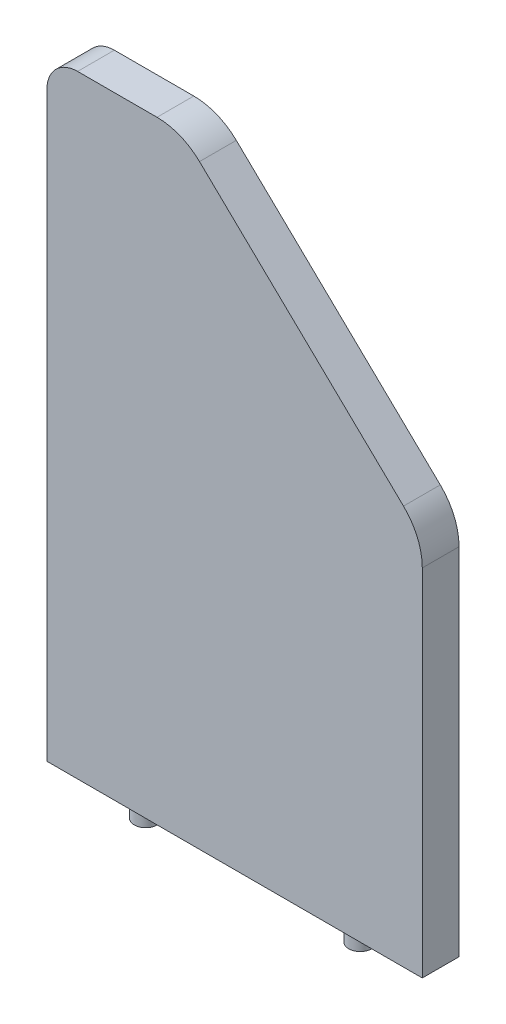
from build123d import *

# Parameters (mm, degrees)
SKETCH4_W                    = 122.5
SKETCH4_H                    = 200
BOSS_EXTRUDE1_DEPTH          = 12
CUT_EXTRUDE1_DEPTH           = 12
FILLET1_R                    = 20
FILLET2_R                    = 20
FILLET3_R                    = 10
SKETCH10_R                   = 3.75
BOSS_EXTRUDE3_DEPTH          = 6
F_5_0_5_DIAMETER_HOLE1_D     = 5
F_5_0_5_DIAMETER_HOLE1_DEPTH = 8
F_5_0_5_DIAMETER_HOLE1_TIP   = 1.502151548
F_5_0_5_DIAMETER_HOLE2_D     = 5
F_5_0_5_DIAMETER_HOLE2_DEPTH = 8
F_5_0_5_DIAMETER_HOLE2_TIP   = 1.502151548


with BuildPart() as part:
    # Sketch4 → Boss-Extrude1 (new body)
    with BuildSketch(Plane.XY):
        with Locations((61.25, 100)):
            Rectangle(SKETCH4_W, SKETCH4_H)
    extrude(amount=BOSS_EXTRUDE1_DEPTH)

    # Sketch7 → Cut-Extrude1 (cut)
    with BuildSketch(Plane.XY.offset(12)):
        Polygon((43.985796602, 200), (122.5, 124.415794753), (122.5, 200), align=None)
    extrude(amount=-CUT_EXTRUDE1_DEPTH, mode=Mode.SUBTRACT)

    # Fillet1
    fillet1_edges = [part.edges().sort_by_distance(p)[0] for p in [
        (43.985796602, 200, 6),
    ]]
    fillet(fillet1_edges, radius=FILLET1_R)

    # Fillet2
    fillet2_edges = [part.edges().sort_by_distance(p)[0] for p in [
        (122.5, 124.415794753, 6),
    ]]
    fillet(fillet2_edges, radius=FILLET2_R)

    # Fillet3
    fillet3_edges = [part.edges().sort_by_distance(p)[0] for p in [
        (0, 200, 6),
    ]]
    fillet(fillet3_edges, radius=FILLET3_R)

    # Sketch10 → Boss-Extrude3 (add)
    with BuildSketch(Plane.XZ):
        with Locations(Location((26.25, 6, 0), (0, 0, 90))):
            Circle(SKETCH10_R)
        with Locations(Location((96.25, 6, 0), (0, 0, 90))):
            Circle(SKETCH10_R)
    extrude(amount=BOSS_EXTRUDE3_DEPTH)

    # Boss-Extrude4 cone 1 section (through the dimple's axis) → Boss-Extrude4 (revolve)
    with BuildSketch(Plane(origin=(26.25, -6, 6), x_dir=(0, 0, 1), z_dir=(1, 0, 0))):
        Polygon((0, 0), (3.75, 0), (0, 1.993910369), align=None)
    revolve(axis=Axis((26.25, -6, 6), (0, -1, 0)))

    # Boss-Extrude4 cone 2 section (through the dimple's axis) → Boss-Extrude4 cone 2 (revolve)
    with BuildSketch(Plane(origin=(96.25, -6, 6), x_dir=(0, 0, 1), z_dir=(1, 0, 0))):
        Polygon((0, 0), (3.75, 0), (0, 1.993910369), align=None)
    revolve(axis=Axis((96.25, -6, 6), (0, -1, 0)))

    # Ø5.0 (5) Diameter Hole1
    with Locations(Plane.ZY):
        with Locations((6, 180)):
            Hole(F_5_0_5_DIAMETER_HOLE1_D / 2, depth=F_5_0_5_DIAMETER_HOLE1_DEPTH)
            with Locations((0, 0, -(F_5_0_5_DIAMETER_HOLE1_DEPTH + F_5_0_5_DIAMETER_HOLE1_TIP / 2))):  # 118° drill point
                Cone(0, F_5_0_5_DIAMETER_HOLE1_D / 2, F_5_0_5_DIAMETER_HOLE1_TIP, mode=Mode.SUBTRACT)

    # Ø5.0 (5) Diameter Hole2
    with Locations(Plane.ZY):
        with Locations((6, 10)):
            Hole(F_5_0_5_DIAMETER_HOLE2_D / 2, depth=F_5_0_5_DIAMETER_HOLE2_DEPTH)
            with Locations((0, 0, -(F_5_0_5_DIAMETER_HOLE2_DEPTH + F_5_0_5_DIAMETER_HOLE2_TIP / 2))):  # 118° drill point
                Cone(0, F_5_0_5_DIAMETER_HOLE2_D / 2, F_5_0_5_DIAMETER_HOLE2_TIP, mode=Mode.SUBTRACT)


solid = part.part
